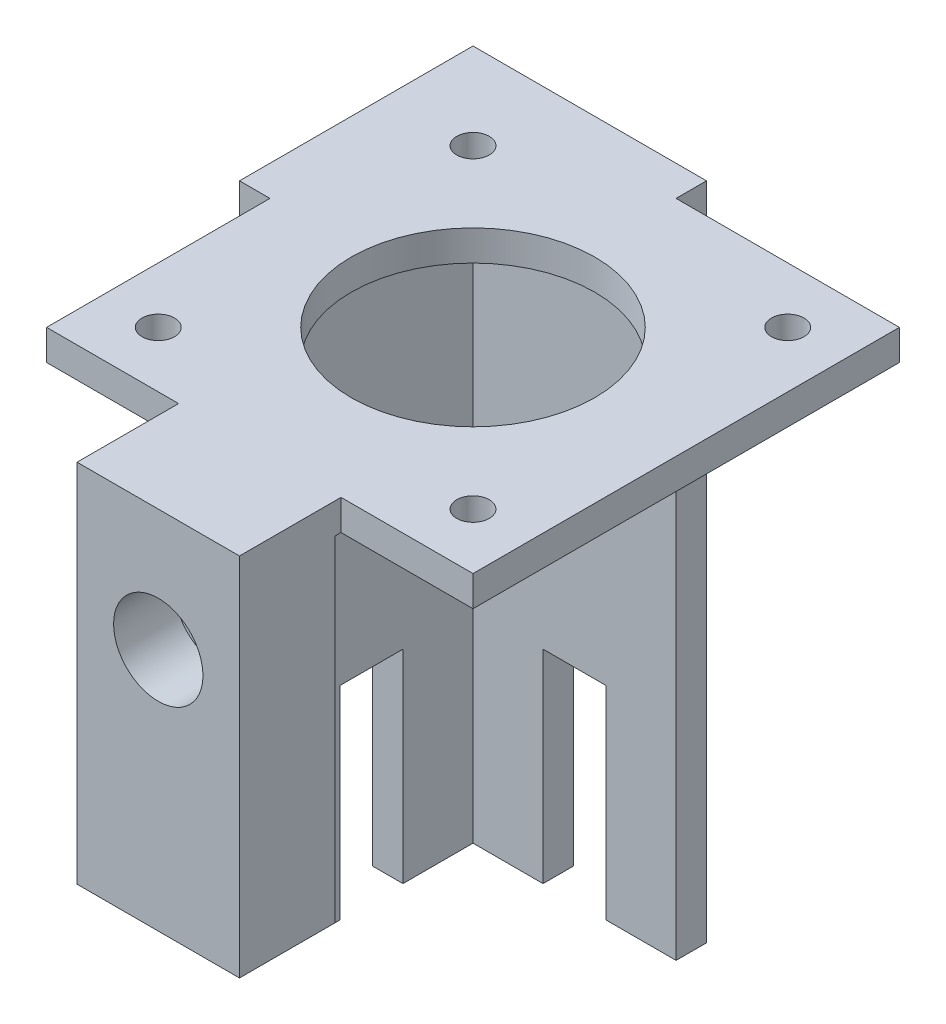
from build123d import *

# Parameters (mm, degrees)
SKETCH_1_W          = 42
SKETCH_1_H          = 42
SKETCH_1_R          = 1.6
SKETCH_1_R_2        = 12
EXTRUDE_1_DEPTH     = 3
SKETCH_2_W          = 16
SKETCH_2_H          = 36
EXTRUDE_2_DEPTH     = 10
SKETCH_3_R          = 4.4
CUT_EXTRUDE_1_DEPTH = 6
EXTRUDE_3_DEPTH     = 65
SKETCH_5_W          = 6.2
SKETCH_5_H          = 20
CUT_EXTRUDE_2_DEPTH = 50
CUT_EXTRUDE_3_REACH = 84.644
SKETCH_6_W          = 6.2
SKETCH_6_H          = 20
SKETCH_7_W          = 16
SKETCH_7_H          = 0.6
CUT_EXTRUDE_4_DEPTH = 33


with BuildPart() as part:
    # 草图1 → 凸台-拉伸1 (new body)
    with BuildSketch(Plane(origin=(0, 0, 0), x_dir=(1, 0, 0), z_dir=(0, 1, 0))):
        Rectangle(SKETCH_1_W, SKETCH_1_H)
        with Locations(Location((15.5, 15.5, 0), (0, 0, 270))):
            Circle(SKETCH_1_R, mode=Mode.SUBTRACT)
        with Locations(Location((15.5, -15.5, 0), (0, 0, 270))):
            Circle(SKETCH_1_R, mode=Mode.SUBTRACT)
        with Locations(Location((-15.5, -15.5, 0), (0, 0, 270))):
            Circle(SKETCH_1_R, mode=Mode.SUBTRACT)
        with Locations(Location((-15.5, 15.5, 0), (0, 0, 270))):
            Circle(SKETCH_1_R, mode=Mode.SUBTRACT)
        with Locations(Location((0, 0, 0), (0, 0, 270))):
            Circle(SKETCH_1_R_2, mode=Mode.SUBTRACT)
    extrude(amount=EXTRUDE_1_DEPTH)

    # 草图2 → 凸台-拉伸2 (add)
    with BuildSketch(Plane.XY.offset(21)):
        with Locations((0, -15)):
            Rectangle(SKETCH_2_W, SKETCH_2_H)
    extrude(amount=EXTRUDE_2_DEPTH)

    # 草图3 → 切除-拉伸1 (cut)
    with BuildSketch(Plane.XY.offset(31)):
        with Locations((0, -9)):
            Circle(SKETCH_3_R)
    extrude(amount=-CUT_EXTRUDE_1_DEPTH, mode=Mode.SUBTRACT)

    # 草图4 → 凸台-拉伸3 (add)
    with BuildSketch(Plane(origin=(0, 3, 0), x_dir=(1, 0, 0), z_dir=(0, 1, 0))):
        Polygon((1, 21), (21, 21), (21, 1), (24, 1), (24, 24), (1, 24), align=None)
    extrude(amount=-EXTRUDE_3_DEPTH)

    # 草图5 → 切除-拉伸2 (cut)
    with BuildSketch(Plane(origin=(0, 0, -24), x_dir=(-1, 0, 0), z_dir=(0, 0, -1))):
        with Locations((-11, -52)):
            Rectangle(SKETCH_5_W, SKETCH_5_H)
    extrude(amount=-CUT_EXTRUDE_2_DEPTH, mode=Mode.SUBTRACT)

    # 草图6 → 切除-拉伸3 (cut, up to next)
    with BuildSketch(Plane(origin=(24, 0, 0), x_dir=(0, 0, -1), z_dir=(1, 0, 0)), mode=Mode.PRIVATE) as cut_extrude_3_sk1:
        with Locations((11, -52)):
            Rectangle(SKETCH_6_W, SKETCH_6_H)
    cut_extrude_3_tool1 = extrude(cut_extrude_3_sk1.sketch, amount=-CUT_EXTRUDE_3_REACH, mode=Mode.PRIVATE) & part.part
    add(cut_extrude_3_tool1.solids().sort_by_distance((24, -52, -11))[0], mode=Mode.SUBTRACT)

    # 草图7 → 切除-拉伸4 (cut)
    with BuildSketch(Plane.XZ.offset(33)):
        with Locations((0, 21.3)):
            Rectangle(SKETCH_7_W, SKETCH_7_H)
    extrude(amount=-CUT_EXTRUDE_4_DEPTH, mode=Mode.SUBTRACT)


with BuildPart() as body_2:
    # 镜向3: mirrored copy
    add(part.part.mirror(Plane.ZY.offset(31)))


solid = body_2.part
